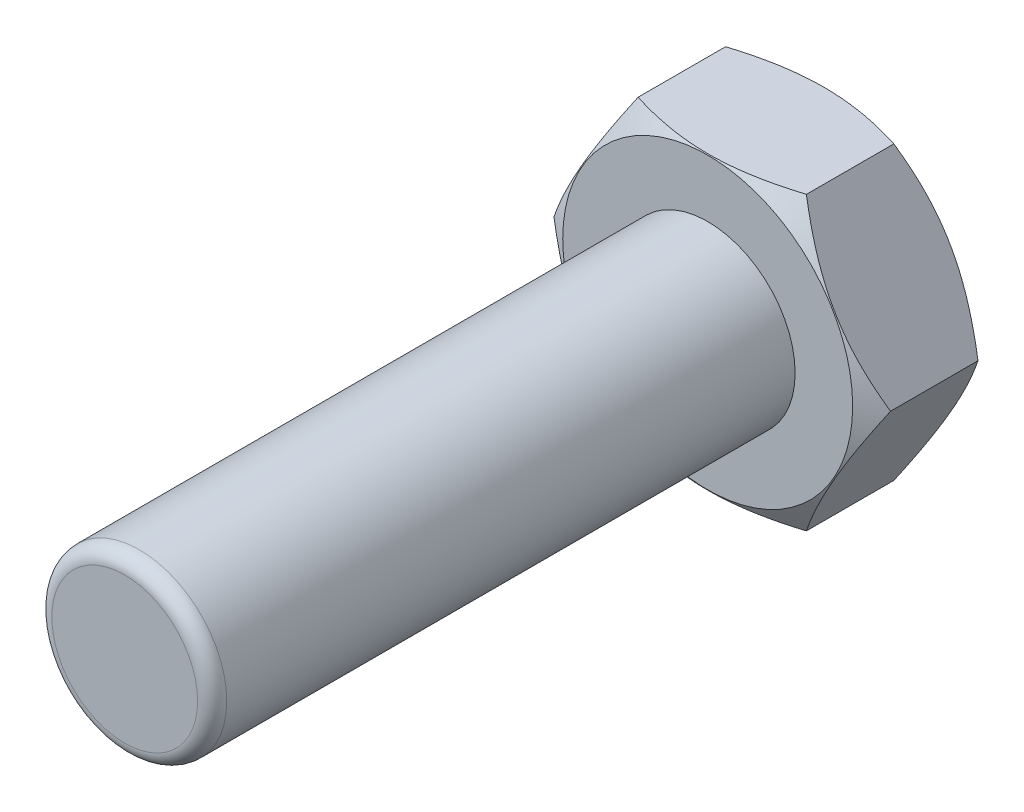
from build123d import *

# Parameters (mm, degrees)
Y_KSEKLIK_EKSTR_ZYON1_DEPTH = 4
IZIM3_R                     = 3
Y_KSEKLIK_EKSTR_ZYON2_DEPTH = 20
RADYUS1_R                   = 0.5


with BuildPart() as part:
    # Çizim1 → Yükseklik-Ekstrüzyon1 (new body)
    with BuildSketch(Plane.XY):
        Polygon((5.773502692, 0), (2.886751346, 5), (-2.886751346, 5), (-5.773502692, 0), (-2.886751346, -5), (2.886751346, -5), align=None)
    extrude(amount=Y_KSEKLIK_EKSTR_ZYON1_DEPTH)

    # Çizim2 → Kes-Döndür1 (revolve, cut)
    with BuildSketch(Plane(origin=(0, 0, 0), x_dir=(1, 0, 0), z_dir=(0, 1, 0))):
        Polygon((-5.773502692, 0), (-5.773502692, -0.5), (-4.973502692, 0), align=None)
        Polygon((-5.773502692, -4), (-5.773502692, -3.5), (-4.973502692, -4), align=None)
    revolve(axis=Axis((0, 0, 0), (0, 0, 1)), mode=Mode.SUBTRACT)

    # Çizim3 → Yükseklik-Ekstrüzyon2 (add)
    with BuildSketch(Plane.XY.offset(4)):
        Circle(IZIM3_R)
    extrude(amount=Y_KSEKLIK_EKSTR_ZYON2_DEPTH)

    # Radyus1
    radyus1_edges = [part.edges().sort_by_distance(p)[0] for p in [
        (-3, 0, 24),
    ]]
    fillet(radyus1_edges, radius=RADYUS1_R)


solid = part.part
